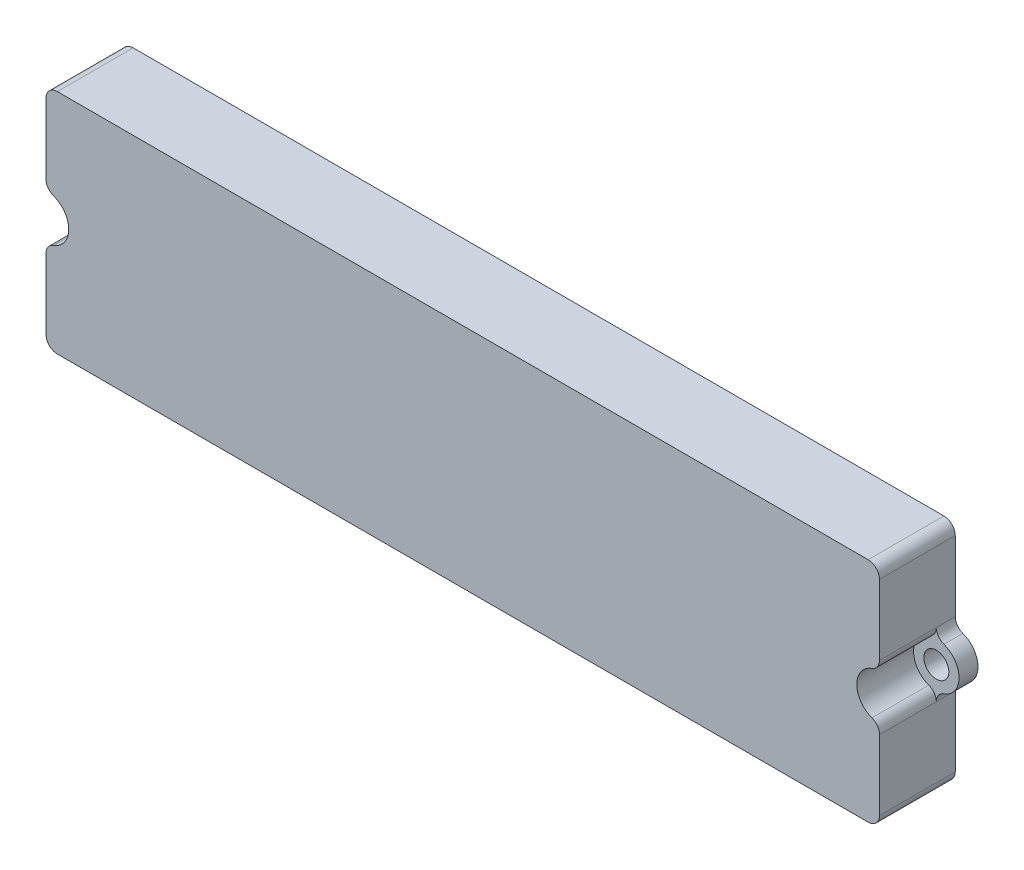
from build123d import *

# Parameters (mm, degrees)
SKETCH1_W           = 220
SKETCH1_H           = 60
BOSS_EXTRUDE1_DEPTH = 20
FILLET1_R           = 3
SKETCH2_R           = 6
BOSS_EXTRUDE2_DEPTH = 20
SKETCH3_R           = 3.3
CUT_EXTRUDE1_DEPTH  = 20
SKETCH4_R           = 6
CUT_EXTRUDE2_DEPTH  = 15
FILLET2_R           = 3
FILLET3_R           = 3
FILLET4_R           = 3
FILLET6_R           = 3
FILLET7_R           = 3


with BuildPart() as part:
    # Sketch1 → Boss-Extrude1 (new body)
    with BuildSketch(Plane.XY):
        Rectangle(SKETCH1_W, SKETCH1_H)
    extrude(amount=BOSS_EXTRUDE1_DEPTH)

    # Fillet1
    fillet1_edges = [part.edges().sort_by_distance(p)[0] for p in [
        (110, -30, 10),
        (-110, -30, 10),
        (-110, 30, 10),
        (110, 30, 10),
    ]]
    fillet(fillet1_edges, radius=FILLET1_R)

    # Sketch2 → Boss-Extrude2 (add)
    with BuildSketch(Plane.XY.offset(20)):
        with Locations((-110, 0)):
            Circle(SKETCH2_R)
        with Locations((110, 0)):
            Circle(SKETCH2_R)
    extrude(amount=-BOSS_EXTRUDE2_DEPTH)

    # Sketch3 → Cut-Extrude1 (cut)
    with BuildSketch(Plane.XY.offset(20)):
        with Locations((-110, 0)):
            Circle(SKETCH3_R)
        with Locations((110, 0)):
            Circle(SKETCH3_R)
    extrude(amount=-CUT_EXTRUDE1_DEPTH, mode=Mode.SUBTRACT)

    # Sketch4 → Cut-Extrude2 (cut)
    with BuildSketch(Plane.XY.offset(20)):
        with Locations((-110, 0)):
            Circle(SKETCH4_R)
        with Locations((110, 0)):
            Circle(SKETCH4_R)
    extrude(amount=-CUT_EXTRUDE2_DEPTH, mode=Mode.SUBTRACT)

    # Fillet2
    fillet2_edges = [part.edges().sort_by_distance(p)[0] for p in [
        (-110, 6, 2.5),
        (-110, -6, 2.5),
    ]]
    fillet(fillet2_edges, radius=FILLET2_R)

    # Fillet3
    fillet3_edges = [part.edges().sort_by_distance(p)[0] for p in [
        (-110, 6, 12.5),
    ]]
    fillet(fillet3_edges, radius=FILLET3_R)

    # Fillet4
    fillet4_edges = [part.edges().sort_by_distance(p)[0] for p in [
        (-110, -6, 12.5),
    ]]
    fillet(fillet4_edges, radius=FILLET4_R)

    # Fillet6
    fillet6_edges = [part.edges().sort_by_distance(p)[0] for p in [
        (110, -6, 2.5),
        (110, 6, 2.5),
    ]]
    fillet(fillet6_edges, radius=FILLET6_R)

    # Fillet7
    fillet7_edges = [part.edges().sort_by_distance(p)[0] for p in [
        (110, 6, 12.5),
        (110, -6, 12.5),
    ]]
    fillet(fillet7_edges, radius=FILLET7_R)


solid = part.part
